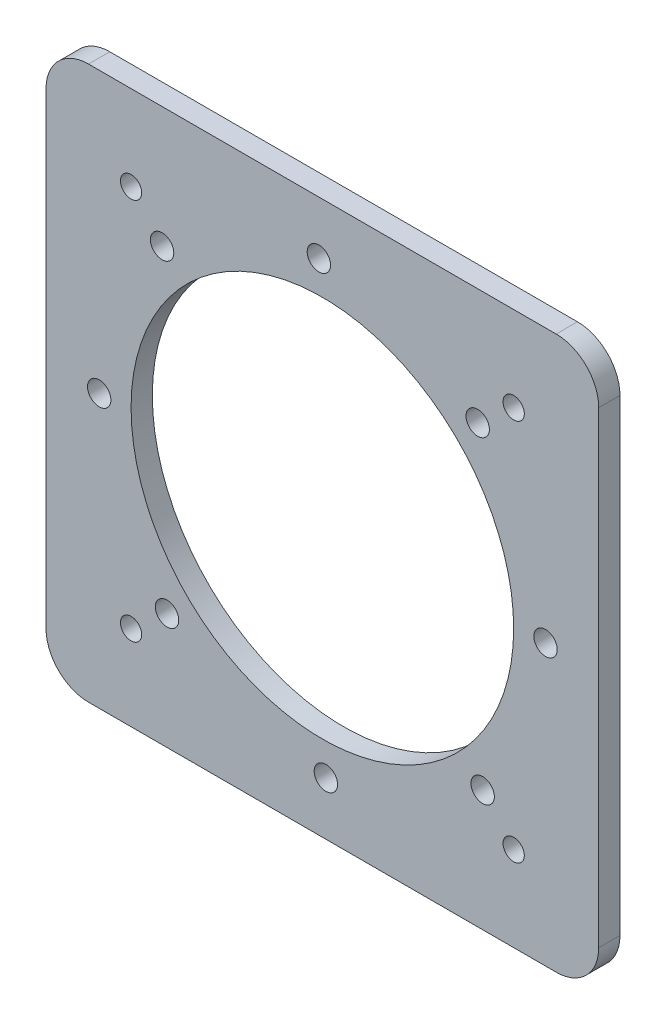
from build123d import *

# Parameters (mm, degrees)
SKETCH_1_W          = 130
SKETCH_1_H          = 130
EXTRUDE_1_DEPTH     = 5
CUT_EXTRUDE_2_REACH = 94.06
SKETCH_5_R          = 45
FILLET_1_R          = 10
CUT_EXTRUDE_3_DEPTH = 10
SKETCH_7_R          = 2.5
CUT_EXTRUDE_4_DEPTH = 93.059763198


with BuildPart() as part:
    # 草图1 → 凸台-拉伸1 (new body)
    with BuildSketch(Plane.XY):
        Rectangle(SKETCH_1_W, SKETCH_1_H)
    extrude(amount=EXTRUDE_1_DEPTH)

    # 草图5 → 切除-拉伸2 (cut, up to next)
    with BuildSketch(Plane(origin=(0, 0, 0), x_dir=(-1, 0, 0), z_dir=(0, 0, -1)), mode=Mode.PRIVATE) as cut_extrude_2_sk1:
        Circle(SKETCH_5_R)
    cut_extrude_2_tool1 = extrude(cut_extrude_2_sk1.sketch, amount=-CUT_EXTRUDE_2_REACH, mode=Mode.PRIVATE) & part.part
    add(cut_extrude_2_tool1.solids().sort_by_distance((0, 0, 0))[0], mode=Mode.SUBTRACT)

    # 圆角1
    fillet_1_edges = [part.edges().sort_by_distance(p)[0] for p in [
        (65, -65, 2.5),
        (-65, -65, 2.5),
        (-65, 65, 2.5),
        (65, 65, 2.5),
    ]]
    fillet(fillet_1_edges, radius=FILLET_1_R)

    # 草图6 → 切除-拉伸3 (cut)
    with BuildSketch(Plane(origin=(0, 0, 0), x_dir=(-1, 0, 0), z_dir=(0, 0, -1))):
        with BuildLine():
            ThreePointArc((39.675797976, 38.449883679), (35.787189387, 38.510902038), (35.726171029, 34.622293449))
            ThreePointArc((35.726171029, 34.622293449), (39.614779618, 34.56127509), (39.675797976, 38.449883679))
        make_face()
        with BuildLine():
            ThreePointArc((54.468351255, 1.090089298), (50.579742665, 1.151107656), (50.518724307, -2.737500933))
            ThreePointArc((50.518724307, -2.737500933), (54.407332896, -2.798519291), (54.468351255, 1.090089298))
        make_face()
        with BuildLine():
            ThreePointArc((38.510902038, -35.787189387), (34.622293449, -35.726171029), (34.56127509, -39.614779618))
            ThreePointArc((34.56127509, -39.614779618), (38.449883679, -39.675797976), (38.510902038, -35.787189387))
        make_face()
        with BuildLine():
            ThreePointArc((1.151107656, -50.579742665), (-2.737500933, -50.518724307), (-2.798519291, -54.407332896))
            ThreePointArc((-2.798519291, -54.407332896), (1.090089298, -54.468351255), (1.151107656, -50.579742665))
        make_face()
        with BuildLine():
            ThreePointArc((-35.726171029, -34.622293449), (-39.614779618, -34.56127509), (-39.675797976, -38.449883679))
            ThreePointArc((-39.675797976, -38.449883679), (-35.787189387, -38.510902038), (-35.726171029, -34.622293449))
        make_face()
        with BuildLine():
            ThreePointArc((-50.518724307, 2.737500933), (-54.407332896, 2.798519291), (-54.468351255, -1.090089298))
            ThreePointArc((-54.468351255, -1.090089298), (-50.579742665, -1.151107656), (-50.518724307, 2.737500933))
        make_face()
        with BuildLine():
            ThreePointArc((-34.56127509, 39.614779618), (-38.449883679, 39.675797976), (-38.510902038, 35.787189387))
            ThreePointArc((-38.510902038, 35.787189387), (-34.622293449, 35.726171029), (-34.56127509, 39.614779618))
        make_face()
        with BuildLine():
            ThreePointArc((2.798519291, 54.407332896), (-1.090089298, 54.468351255), (-1.151107656, 50.579742665))
            ThreePointArc((-1.151107656, 50.579742665), (2.737500933, 50.518724307), (2.798519291, 54.407332896))
        make_face()
    extrude(amount=-CUT_EXTRUDE_3_DEPTH, mode=Mode.SUBTRACT)

    # 草图7 → 切除-拉伸4 (cut, through all)
    with BuildSketch(Plane.XY.offset(5)):
        with Locations((-45, 45)):
            Circle(SKETCH_7_R)
        with Locations((45, 45)):
            Circle(SKETCH_7_R)
        with Locations((45, -45)):
            Circle(SKETCH_7_R)
        with Locations((-45, -45)):
            Circle(SKETCH_7_R)
    extrude(amount=-CUT_EXTRUDE_4_DEPTH, mode=Mode.SUBTRACT)


solid = part.part
